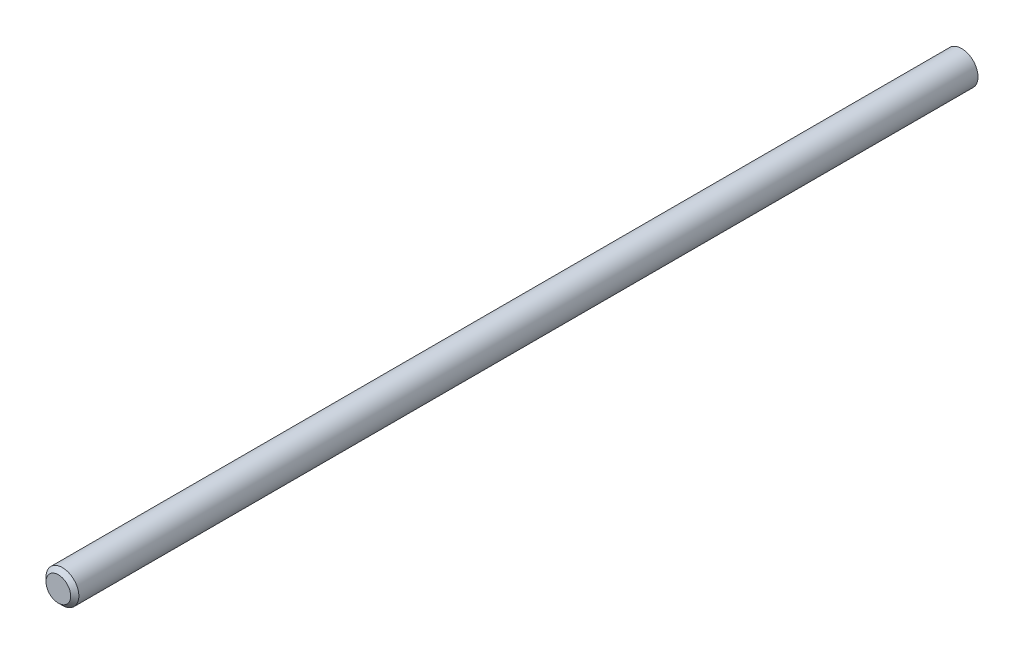
from build123d import *

# Parameters (mm, degrees)
SKETCH_1_R      = 4
EXTRUDE_1_DEPTH = 220
CHAMFER_1_SIZE  = 1


with BuildPart() as part:
    # 草图1 → 凸台-拉伸1 (new body)
    with BuildSketch(Plane.XY):
        Circle(SKETCH_1_R)
    extrude(amount=EXTRUDE_1_DEPTH)

    # 倒角1
    chamfer_1_edges = [part.edges().sort_by_distance(p)[0] for p in [
        (-4, 0, 220),
    ]]
    chamfer(chamfer_1_edges, length=CHAMFER_1_SIZE)


solid = part.part
